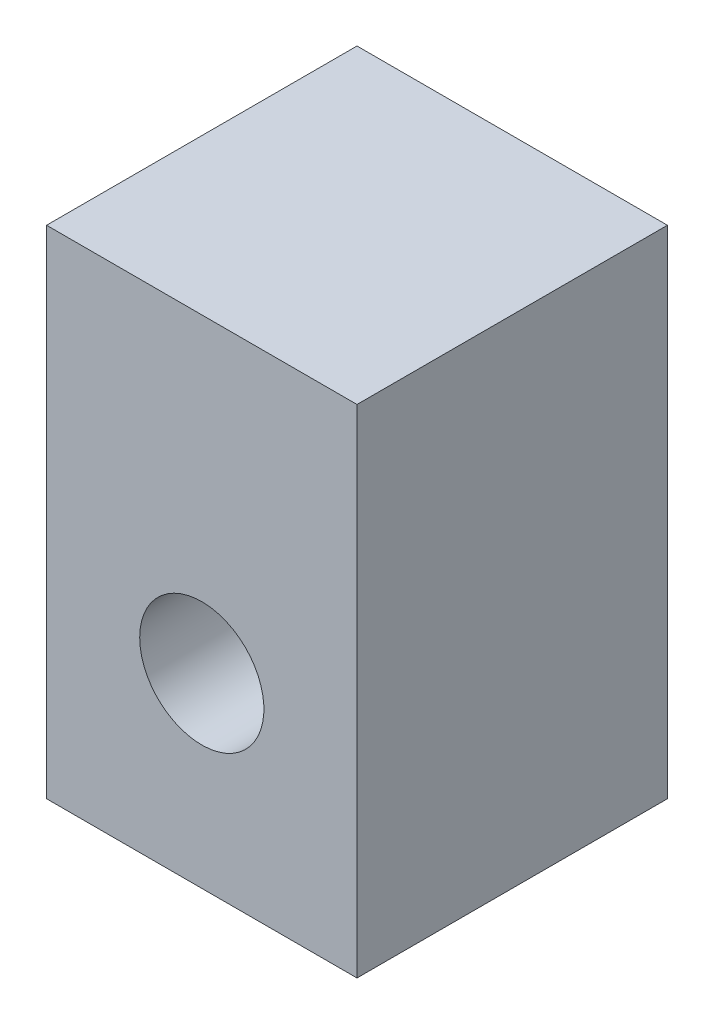
from build123d import *

# Parameters (mm, degrees)
SKETCH1_W           = 10
SKETCH1_H           = 16
SKETCH1_R           = 2
BOSS_EXTRUDE1_DEPTH = 10


with BuildPart() as part:
    # Sketch1 → Boss-Extrude1 (new body)
    with BuildSketch(Plane(origin=(0, 0, 0), x_dir=(-1.0, 0, 8.723016310561762e-12), z_dir=(-8.723016310561762e-12, 5.3094256425393756e-15, -1.0))):
        with Locations((79.539990831, 54.5)):
            Rectangle(SKETCH1_W, SKETCH1_H)
        with Locations((79.539990831, 52.5)):
            Circle(SKETCH1_R, mode=Mode.SUBTRACT)
    extrude(amount=-BOSS_EXTRUDE1_DEPTH)


solid = part.part
